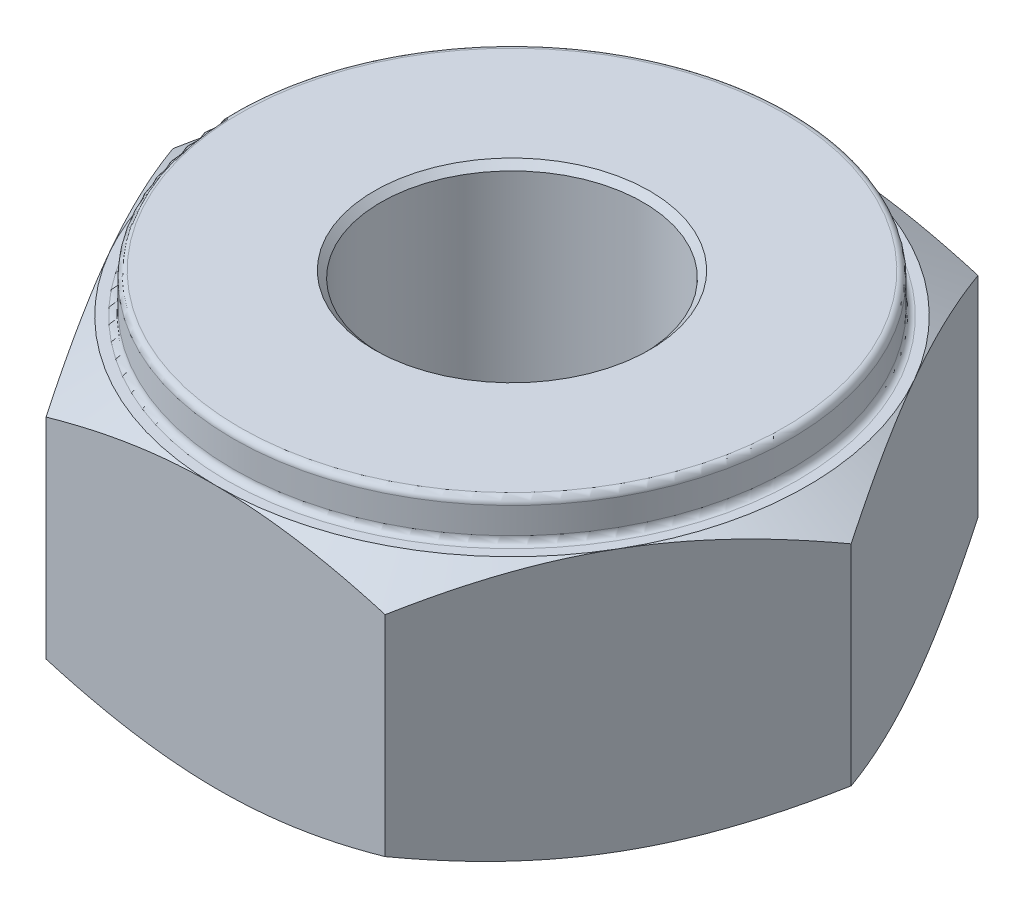
from build123d import *

# Parameters (mm, degrees)
SKETCH1_R           = 1
BOSS_EXTRUDE1_DEPTH = 2
SKETCH2_OUTSIDE_W   = 12.094
SKETCH2_OUTSIDE_H   = 11.41
SKETCH2_OUTSIDE_R   = 2.25
CUT_EXTRUDE2_DEPTH  = 1
CUT_EXTRUDE2_DRAFT  = -60
SKETCH3_OUTSIDE_W   = 12.094
SKETCH3_OUTSIDE_H   = 11.41
SKETCH3_OUTSIDE_R   = 2.25
CUT_EXTRUDE3_DEPTH  = 1
CUT_EXTRUDE3_DRAFT  = -60
SKETCH4_R           = 2.125
SKETCH4_R_2         = 1
BOSS_EXTRUDE2_DEPTH = 0.3
FILLET1_R           = 0.05
CHAMFER1_SIZE       = 0.05


with BuildPart() as part:
    # Sketch1 → Boss-Extrude1 (new body)
    with BuildSketch(Plane(origin=(0, 0, 0), x_dir=(1, 0, 0), z_dir=(0, 1, 0))):
        Polygon((1.309294077, 2.244047464), (-1.288755073, 2.255905663), (-2.598049149, 0.011858199), (-1.309294077, -2.244047464), (1.288755073, -2.255905663), (2.598049149, -0.011858199), align=None)
        with Locations(Location((0, 0, 0), (0, 0, 270))):
            Circle(SKETCH1_R, mode=Mode.SUBTRACT)
    extrude(amount=BOSS_EXTRUDE1_DEPTH)


with BuildPart() as cut_extrude2_tool:
    # Sketch2 outside → Cut-Extrude2 (with draft: the straight prism first)
    with BuildSketch(Plane(origin=(0, 2, 0), x_dir=(1, 0, 0), z_dir=(0, 1, 0))):
        Rectangle(SKETCH2_OUTSIDE_W, SKETCH2_OUTSIDE_H)
        Circle(SKETCH2_OUTSIDE_R, mode=Mode.SUBTRACT)
    extrude(amount=-CUT_EXTRUDE2_DEPTH)
    # Cut-Extrude2: the draft: its side faces are tilted about the plane it starts from
    cut_extrude2_sides = [cut_extrude2_tool.faces().sort_by_distance(p)[0] for p in [
        (0, 1.5, 5.705),
        (6.047, 1.5, 0),
        (0, 1.5, -5.705),
        (-6.047, 1.5, 0),
        (-2.25, 1.5, 0),
    ]]
    draft(cut_extrude2_sides, Plane(origin=(0, 2, 0), x_dir=(1, 0, 0), z_dir=(0, 1, 0)), CUT_EXTRUDE2_DRAFT)


with BuildPart() as part_1:
    add(part.part)

    # Cut-Extrude2: cut by cut_extrude2_tool
    add(cut_extrude2_tool.part, mode=Mode.SUBTRACT)


with BuildPart() as cut_extrude3_tool:
    # Sketch3 outside → Cut-Extrude3 (with draft: the straight prism first)
    with BuildSketch(Plane.XZ):
        Rectangle(SKETCH3_OUTSIDE_W, SKETCH3_OUTSIDE_H)
        Circle(SKETCH3_OUTSIDE_R, mode=Mode.SUBTRACT)
    extrude(amount=-CUT_EXTRUDE3_DEPTH)
    # Cut-Extrude3: the draft: its side faces are tilted about the plane it starts from
    cut_extrude3_sides = [cut_extrude3_tool.faces().sort_by_distance(p)[0] for p in [
        (0, 0.5, -5.705),
        (6.047, 0.5, 0),
        (0, 0.5, 5.705),
        (-6.047, 0.5, 0),
        (-2.25, 0.5, 0),
    ]]
    draft(cut_extrude3_sides, Plane.XZ, CUT_EXTRUDE3_DRAFT)


with BuildPart() as part_2:
    add(part_1.part)

    # Cut-Extrude3: cut by cut_extrude3_tool
    add(cut_extrude3_tool.part, mode=Mode.SUBTRACT)

    # Sketch4 → Boss-Extrude2 (add)
    with BuildSketch(Plane(origin=(0, 2, 0), x_dir=(1, 0, 0), z_dir=(0, 1, 0))):
        with Locations(Location((0, 0, 0), (0, 0, 270))):
            Circle(SKETCH4_R)
        with Locations(Location((0, 0, 0), (0, 0, 270))):
            Circle(SKETCH4_R_2, mode=Mode.SUBTRACT)
    extrude(amount=BOSS_EXTRUDE2_DEPTH)

    # Fillet1
    fillet1_edges = [part_2.edges().sort_by_distance(p)[0] for p in [
        (0, 2.3, -2.125),
        (0, 2, -2.125),
    ]]
    fillet(fillet1_edges, radius=FILLET1_R)

    # Chamfer1
    chamfer1_edges = [part_2.edges().sort_by_distance(p)[0] for p in [
        (0, 2.3, -1),
        (0, 0, -1),
    ]]
    chamfer(chamfer1_edges, length=CHAMFER1_SIZE)


solid = part_2.part
